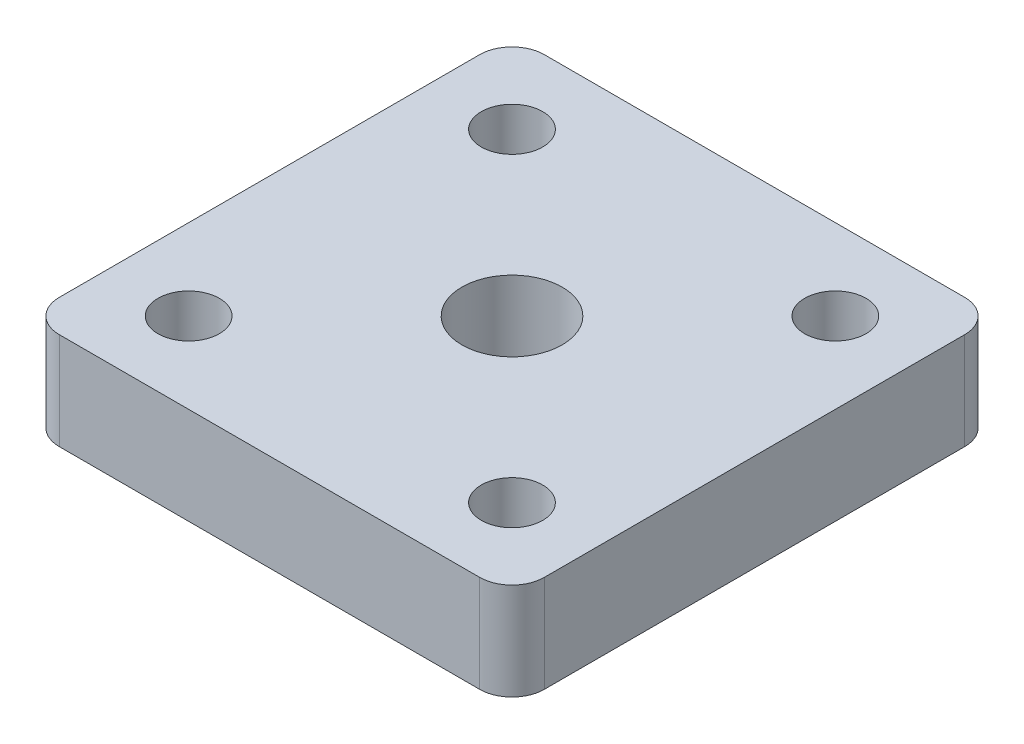
from build123d import *

# Parameters (mm, degrees)
SKETCH1_R             = 3.1
BOSS_EXTRUDE1_DEPTH   = 6
F_6_CLEARANCE_HOLE1_D = 3.7973


with BuildPart() as part:
    # Sketch1 → Boss-Extrude1 (new body)
    with BuildSketch(Plane(origin=(0, 0, 0), x_dir=(1, 0, 0), z_dir=(0, 1, 0))):
        with BuildLine():
            Line((-13, 15), (13, 15))
            ThreePointArc((13, 15), (14.414213562, 14.414213562), (15, 13))
            Line((15, 13), (15, -13))
            ThreePointArc((15, -13), (14.414213562, -14.414213562), (13, -15))
            Line((13, -15), (-13, -15))
            ThreePointArc((-13, -15), (-14.414213562, -14.414213562), (-15, -13))
            Line((-15, -13), (-15, 13))
            ThreePointArc((-15, 13), (-14.414213562, 14.414213562), (-13, 15))
        make_face()
        with Locations(Location((0, 0, 0), (0, 0, 270))):
            Circle(SKETCH1_R, mode=Mode.SUBTRACT)
    extrude(amount=BOSS_EXTRUDE1_DEPTH)

    # #6 Clearance Hole1 (through all)
    with Locations(Plane(origin=(0, 6, 0), x_dir=(1, 0, 0), z_dir=(0, 1, 0))):
        with Locations((-10, 10), (10, 10), (-10, -10), (10, -10)):
            Hole(F_6_CLEARANCE_HOLE1_D / 2)


solid = part.part
